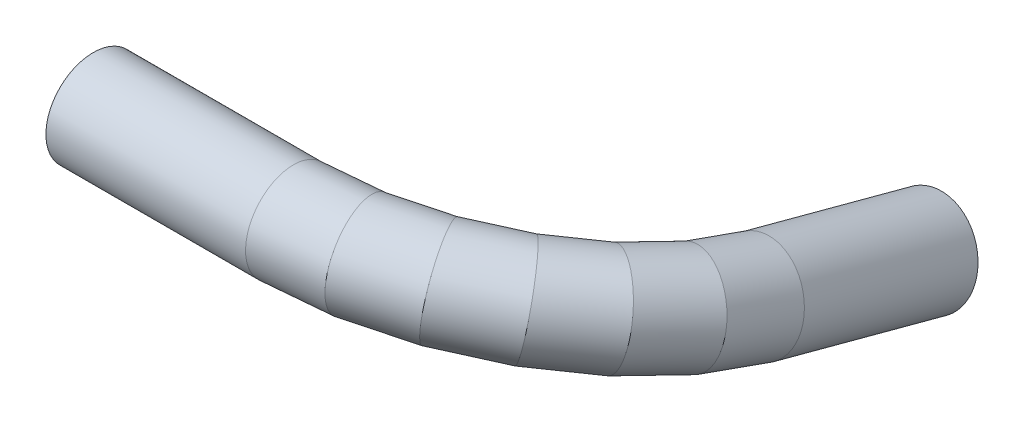
from build123d import *

# Parameters (mm, degrees)
PROFILE_R   = 4.7625
PROFILE_R_2 = 3.8735


with BuildPart() as part:
    # Tube: sweep along a curve in space
    with BuildLine() as tube_path:
        Line((-2198.887960479, -22.400788354, -83.600880265), (-2179.087960479, -22.400788354, -83.600880265))
        Line((-2179.087960479, -22.400788354, -83.600880265), (-2172.876303396, -22.612445436, -84.390795251))
        Line((-2172.876303396, -22.612445436, -84.390795251), (-2167.087960479, -23.232992603, -86.706708807))
        Line((-2167.087960479, -23.232992603, -86.706708807), (-2162.11739773, -24.220140591, -90.390795251))
        Line((-2162.11739773, -24.220140591, -90.390795251), (-2158.303350788, -25.506616895, -95.191990181))
        Line((-2158.303350788, -25.506616895, -95.191990181), (-2155.905740648, -27.004750281, -100.783100096))
        Line((-2155.905740648, -27.004750281, -100.783100096), (-2155.087960479, -28.612445436, -106.783100096))
        Line((-2155.087960479, -28.612445436, -106.783100096), (-2155.087960479, -33.219424439, -123.976579804))
    # Profile → Tube (sweep)
    with BuildSketch(Plane(origin=(-2198.887960479, 0, 0), x_dir=(0, 0, -1), z_dir=(1, 0, 0))):
        with Locations((83.600880265, -22.400788354)):
            Circle(PROFILE_R)
        with Locations((83.600880265, -22.400788354)):
            Circle(PROFILE_R_2, mode=Mode.SUBTRACT)
    sweep(path=tube_path.line, transition=Transition.RIGHT)


solid = part.part
